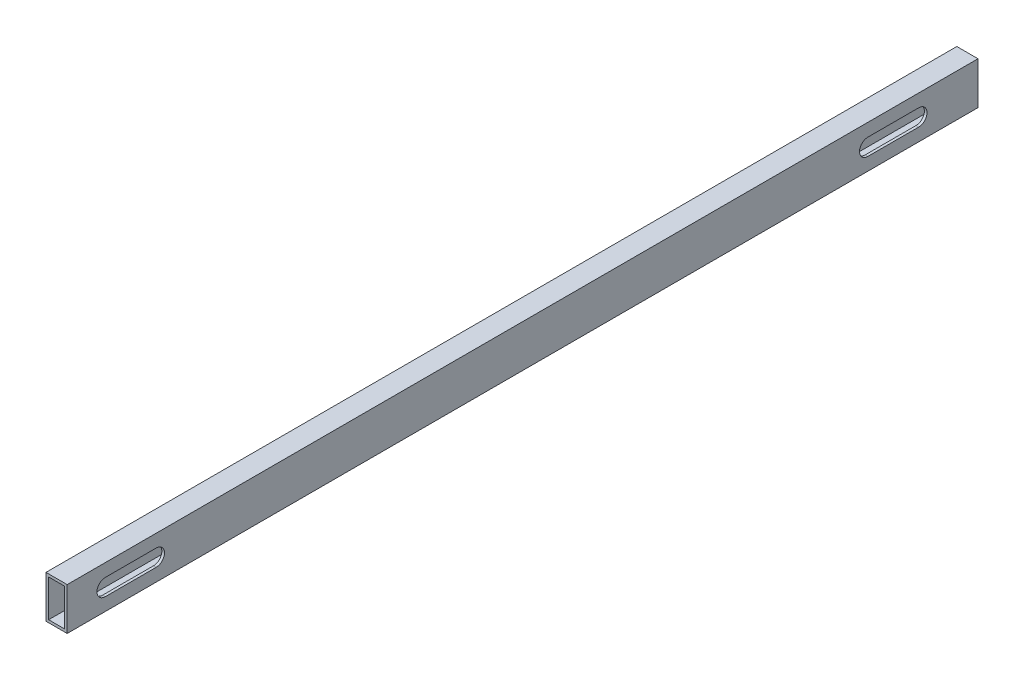
from build123d import *

# Parameters (mm, degrees)
SKETCH1_W           = 12.7
SKETCH1_H           = 25.4
SKETCH1_W_2         = 9.525
SKETCH1_H_2         = 22.225
BOSS_EXTRUDE1_DEPTH = 546.1
SKETCH2_R           = 3.81
SKETCH2_R_2         = 2.75
CUT_EXTRUDE1_DEPTH  = 547.395269013
CUT_EXTRUDE3_REACH  = 548.395
CUT_EXTRUDE5_REACH  = 548.727
SKETCH5_R           = 2.75


with BuildPart() as part:
    # Sketch1 → Boss-Extrude1 (new body)
    with BuildSketch(Plane.XY):
        Rectangle(SKETCH1_W, SKETCH1_H)
        Rectangle(SKETCH1_W_2, SKETCH1_H_2, mode=Mode.SUBTRACT)
    extrude(amount=BOSS_EXTRUDE1_DEPTH)

    # Sketch2 → Cut-Extrude1 (cut, through all)
    with BuildSketch(Plane(origin=(6.35, 0, 0), x_dir=(0, 0, -1), z_dir=(1, 0, 0))):
        with Locations((-508, 0)):
            Circle(SKETCH2_R)
        with Locations((-523.24, 0)):
            Circle(SKETCH2_R_2)
        with Locations((-492.76, 0)):
            Circle(SKETCH2_R_2)
        with BuildLine():
            Line((-44.45, -3.302), (-57.15, -3.302))
            ThreePointArc((-57.15, -3.302), (-60.452, 0), (-57.15, 3.302))
            Line((-57.15, 3.302), (-44.45, 3.302))
            ThreePointArc((-44.45, 3.302), (-41.148, 0), (-44.45, -3.302))
        make_face()
    extrude(amount=-CUT_EXTRUDE1_DEPTH, mode=Mode.SUBTRACT)

    # Sketch4 → Cut-Extrude3 (cut, up to next)
    with BuildSketch(Plane.ZY.offset(-6.35), mode=Mode.PRIVATE) as cut_extrude3_sk1:
        with BuildLine():
            Line((35.56, 5), (66.04, 5))
            ThreePointArc((66.04, 5), (71.04, 0), (66.04, -5))
            Line((66.04, -5), (35.56, -5))
            ThreePointArc((35.56, -5), (30.56, 0), (35.56, 5))
        make_face()
    cut_extrude3_tool1 = extrude(cut_extrude3_sk1.sketch, amount=CUT_EXTRUDE3_REACH, mode=Mode.PRIVATE) & part.part
    # Sketch4 → Cut-Extrude3 (cut, up to next)
    with BuildSketch(Plane.ZY.offset(-6.35), mode=Mode.PRIVATE) as cut_extrude3_sk2:
        with BuildLine():
            Line((492.76, 5), (523.24, 5))
            ThreePointArc((523.24, 5), (528.24, 0), (523.24, -5))
            Line((523.24, -5), (492.76, -5))
            ThreePointArc((492.76, -5), (487.76, 0), (492.76, 5))
        make_face()
    cut_extrude3_tool2 = extrude(cut_extrude3_sk2.sketch, amount=CUT_EXTRUDE3_REACH, mode=Mode.PRIVATE) & part.part
    add(cut_extrude3_tool1.solids().sort_by_distance((6.35, 0, 50.8))[0], mode=Mode.SUBTRACT)
    add(cut_extrude3_tool2.solids().sort_by_distance((6.35, 0, 508))[0], mode=Mode.SUBTRACT)

    # Sketch5 → Cut-Extrude5 (cut, up to next)
    with BuildSketch(Plane.XZ.offset(12.7), mode=Mode.PRIVATE) as cut_extrude5_sk1:
        with Locations(Location((0, 533.4, 0), (0, 0, 270))):
            Circle(SKETCH5_R)
    cut_extrude5_tool1 = extrude(cut_extrude5_sk1.sketch, amount=-CUT_EXTRUDE5_REACH, mode=Mode.PRIVATE) & part.part
    # Sketch5 → Cut-Extrude5 (cut, up to next)
    with BuildSketch(Plane.XZ.offset(12.7), mode=Mode.PRIVATE) as cut_extrude5_sk2:
        with Locations(Location((0, 12.7, 0), (0, 0, 270))):
            Circle(SKETCH5_R)
    cut_extrude5_tool2 = extrude(cut_extrude5_sk2.sketch, amount=-CUT_EXTRUDE5_REACH, mode=Mode.PRIVATE) & part.part
    add(cut_extrude5_tool1.solids().sort_by_distance((0, -12.7, 533.4))[0], mode=Mode.SUBTRACT)
    add(cut_extrude5_tool2.solids().sort_by_distance((0, -12.7, 12.7))[0], mode=Mode.SUBTRACT)


solid = part.part
